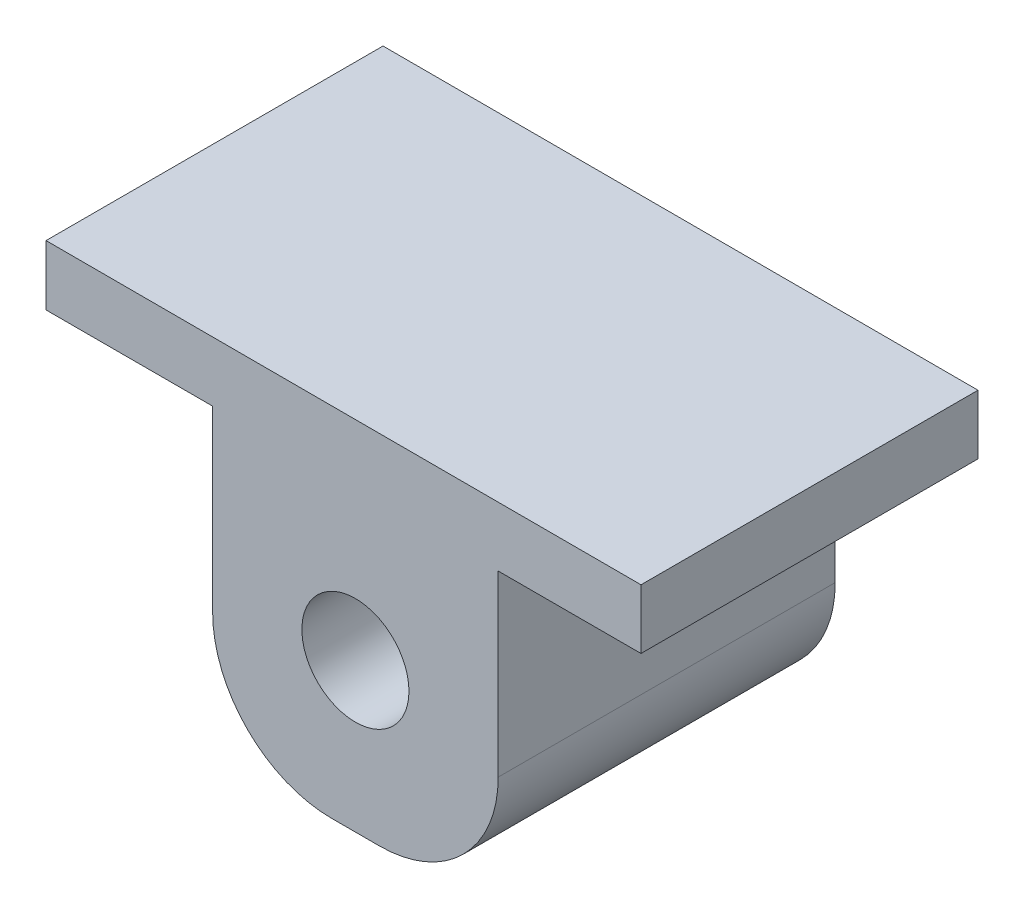
from build123d import *

# Parameters (mm, degrees)
CROQUIS1_R              = 4.5
SALIENTE_EXTRUIR1_DEPTH = 28.32
REDONDEO1_R             = 10


with BuildPart() as part:
    # Croquis1 → Saliente-Extruir1 (new body)
    with BuildSketch(Plane.XY):
        Polygon((0.527798388, 0.005572044), (50.52777288, -0.044933007), (50.527798388, -5.044933007), (38.527798388, -5.044933007), (38.527798388, -30.044933007), (14.527798388, -30.044933007), (14.527798388, -5.044933007), (0.524677348, -5.044933007), align=None)
        with Locations((26.527798388, -17.544933007)):
            Circle(CROQUIS1_R, mode=Mode.SUBTRACT)
    extrude(amount=SALIENTE_EXTRUIR1_DEPTH)

    # Redondeo1
    redondeo1_edges = [part.edges().sort_by_distance(p)[0] for p in [
        (38.527798388, -30.044933007, 14.16),
        (14.527798388, -30.044933007, 14.16),
    ]]
    fillet(redondeo1_edges, radius=REDONDEO1_R)


solid = part.part
